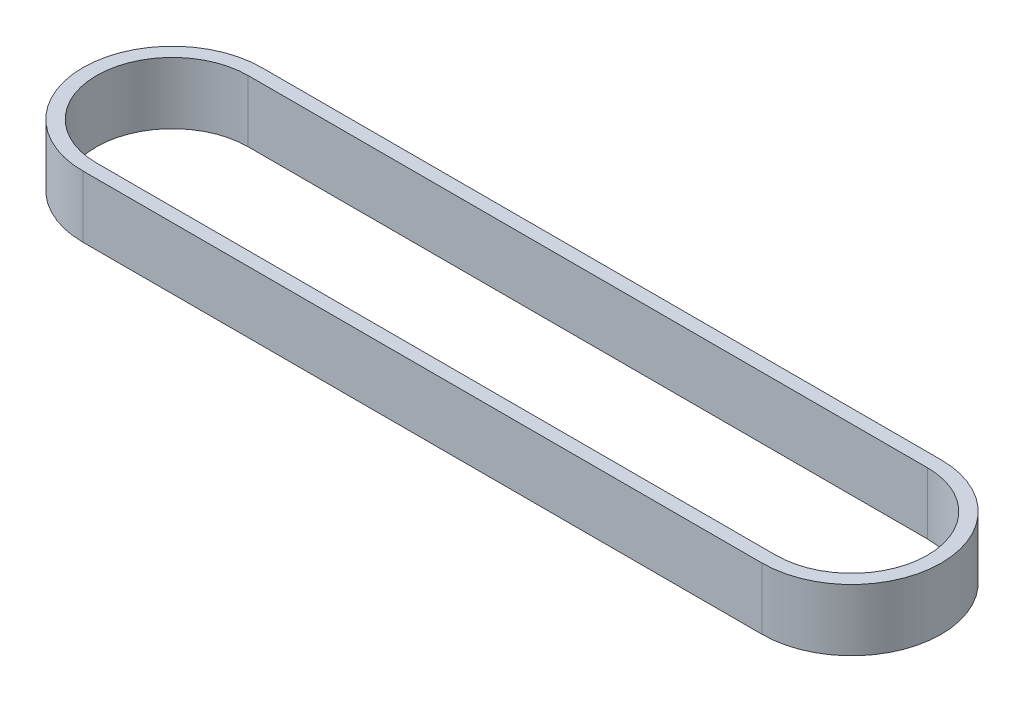
from build123d import *

# Parameters (mm, degrees)
BOSS_EXTRUDE1_DEPTH = 9


with BuildPart() as part:
    # Sketch1 → Boss-Extrude1 (new body)
    with BuildSketch(Plane(origin=(0, 0, 0), x_dir=(1, 0, 0), z_dir=(0, 1, 0))):
        with BuildLine():
            Line((49.53, -13.049), (-49.53, -13.049))
            ThreePointArc((-49.53, -13.049), (-62.579, 0), (-49.53, 13.049))
            Line((-49.53, 13.049), (49.53, 13.049))
            ThreePointArc((49.53, 13.049), (62.579, 0), (49.53, -13.049))
        make_face()
        with BuildLine():
            Line((49.53, -11.049), (-49.53, -11.049))
            ThreePointArc((-49.53, -11.049), (-60.579, 0), (-49.53, 11.049))
            Line((-49.53, 11.049), (49.53, 11.049))
            ThreePointArc((49.53, 11.049), (60.579, 0), (49.53, -11.049))
        make_face(mode=Mode.SUBTRACT)
    extrude(amount=BOSS_EXTRUDE1_DEPTH)


solid = part.part
